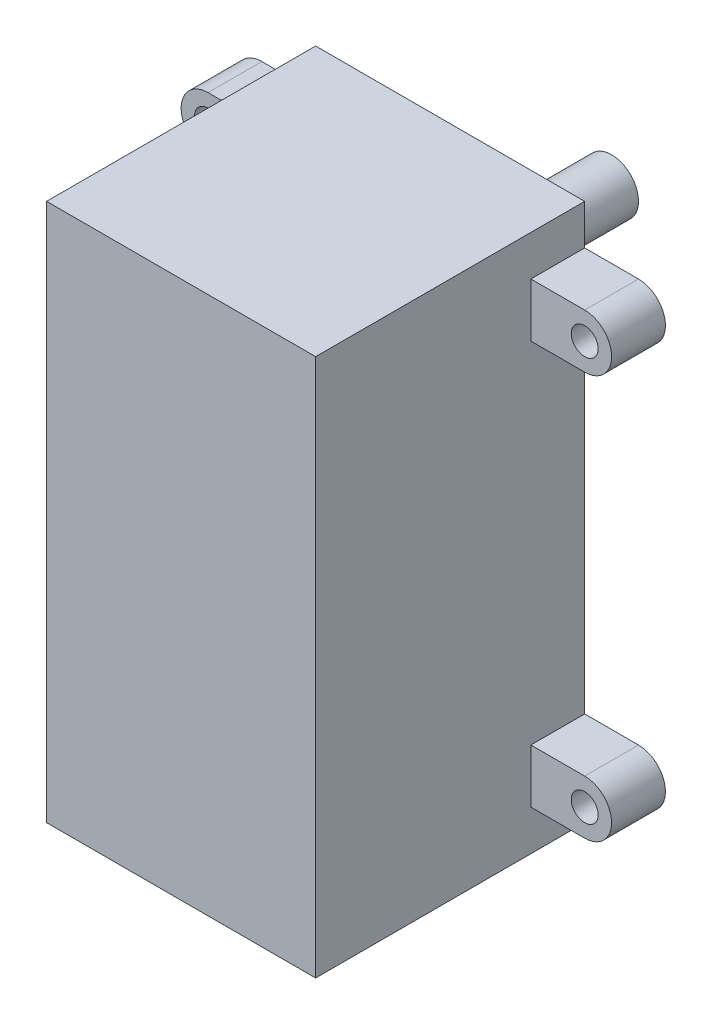
from build123d import *

# Parameters (mm, degrees)
SKETCH1_W           = 100
SKETCH1_H           = 50
BOSS_EXTRUDE1_DEPTH = 50
SKETCH2_R           = 2.5
BOSS_EXTRUDE2_DEPTH = 10
SKETCH3_R           = 5
BOSS_EXTRUDE3_DEPTH = 30


with BuildPart() as part:
    # Sketch1 → Boss-Extrude1 (new body)
    with BuildSketch(Plane(origin=(0, 0, 0), x_dir=(0, 1, 0), z_dir=(0, 0, 1))):
        with Locations((45, -21.706161137)):
            Rectangle(SKETCH1_W, SKETCH1_H)
    extrude(amount=BOSS_EXTRUDE1_DEPTH)

    # Sketch2 → Boss-Extrude2 (add)
    # profile 1 of 4: a face of its own
    with BuildSketch(Plane(origin=(0, 0, 0), x_dir=(1, 0, 0), z_dir=(0, 0, -1))):
        with BuildLine():
            Line((-3.293838863, -2.5), (-13.293838863, -2.5))
            ThreePointArc((-13.293838863, -2.5), (-18.293838863, -7.5), (-13.293838863, -12.5))
            Line((-13.293838863, -12.5), (-3.293838863, -12.5))
            Line((-3.293838863, -12.5), (-3.293838863, -2.5))
        make_face()
        with Locations(Location((-13.293838863, -7.5, 0), (0, 0, 180))):
            Circle(SKETCH2_R, mode=Mode.SUBTRACT)
    # profile 2 of 4: a face of its own
    with BuildSketch(Plane(origin=(0, 0, 0), x_dir=(1, 0, 0), z_dir=(0, 0, -1))):
        with BuildLine():
            Line((-3.293838863, -77.5), (-3.293838863, -87.5))
            Line((-3.293838863, -87.5), (-13.293838863, -87.5))
            ThreePointArc((-13.293838863, -87.5), (-18.293838863, -82.5), (-13.293838863, -77.5))
            Line((-13.293838863, -77.5), (-3.293838863, -77.5))
        make_face()
        with Locations((-13.293838863, -82.5)):
            Circle(SKETCH2_R, mode=Mode.SUBTRACT)
    # profile 3 of 4: a face of its own
    with BuildSketch(Plane(origin=(0, 0, 0), x_dir=(1, 0, 0), z_dir=(0, 0, -1))):
        with BuildLine():
            Line((46.706161137, -87.5), (56.706161137, -87.5))
            ThreePointArc((56.706161137, -87.5), (61.706161137, -82.5), (56.706161137, -77.5))
            Line((56.706161137, -77.5), (46.706161137, -77.5))
            Line((46.706161137, -77.5), (46.706161137, -87.5))
        make_face()
        with Locations(Location((56.706161137, -82.5, 0), (0, 0, 180))):
            Circle(SKETCH2_R, mode=Mode.SUBTRACT)
    # profile 4 of 4: a face of its own
    with BuildSketch(Plane(origin=(0, 0, 0), x_dir=(1, 0, 0), z_dir=(0, 0, -1))):
        with BuildLine():
            Line((46.706161137, -12.5), (46.706161137, -2.5))
            Line((46.706161137, -2.5), (56.706161137, -2.5))
            ThreePointArc((56.706161137, -2.5), (61.706161137, -7.5), (56.706161137, -12.5))
            Line((56.706161137, -12.5), (46.706161137, -12.5))
        make_face()
        with Locations((56.706161137, -7.5)):
            Circle(SKETCH2_R, mode=Mode.SUBTRACT)
    extrude(amount=-BOSS_EXTRUDE2_DEPTH)

    # Sketch3 → Boss-Extrude3 (add)
    with BuildSketch(Plane(origin=(0, 0, 0), x_dir=(1, 0, 0), z_dir=(0, 0, -1))):
        with Locations(Location((21.706161137, -70, 0), (0, 0, 180))):
            Circle(SKETCH3_R)
    extrude(amount=BOSS_EXTRUDE3_DEPTH)


solid = part.part
